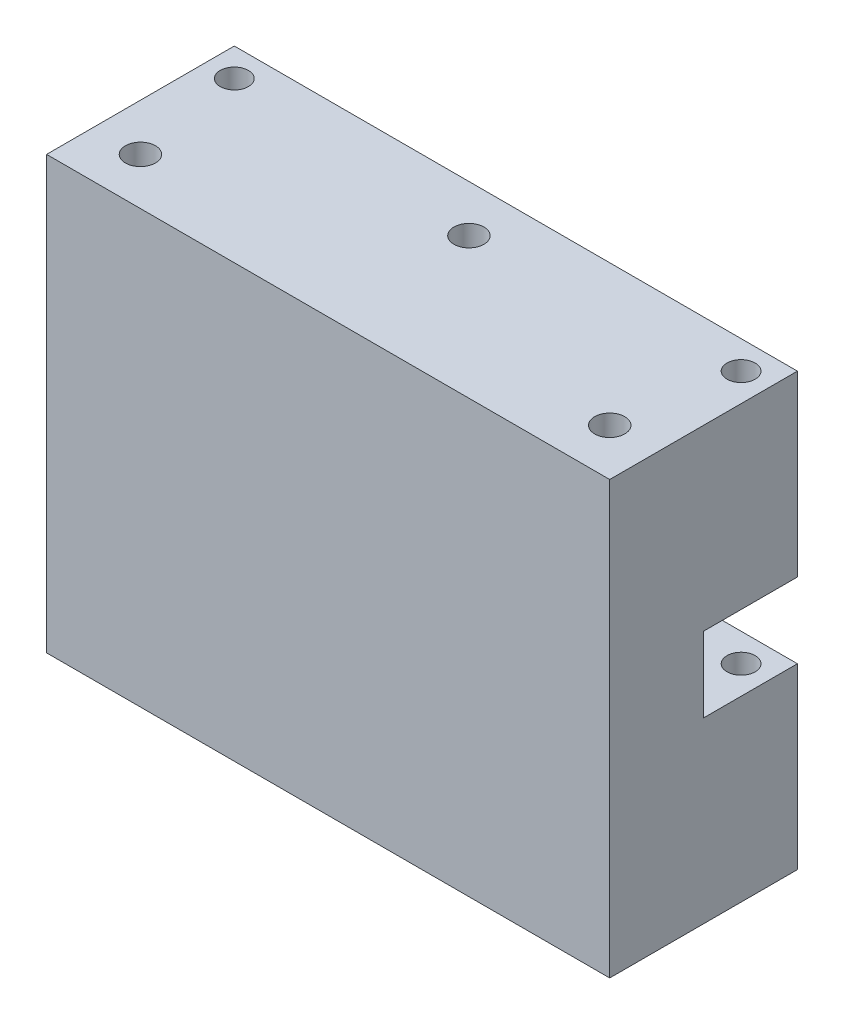
from build123d import *

# Parameters (mm, degrees)
SKETCH1_W             = 60
SKETCH1_H             = 20
BOSS_EXTRUDE1_DEPTH   = 46
SKETCH2_W             = 10
SKETCH2_H             = 8
CUT_EXTRUDE1_DEPTH    = 10
F_3_0MM_DOWEL_HOLE1_D = 3
SKETCH5_W             = 10
SKETCH5_H             = 10
CUT_EXTRUDE2_DEPTH    = 10
M3_CLEARANCE_HOLE1_D  = 3.2


with BuildPart() as part:
    # Sketch1 → Boss-Extrude1 (new body)
    with BuildSketch(Plane(origin=(0, 0, 0), x_dir=(1, 0, 0), z_dir=(0, 1, 0))):
        Rectangle(SKETCH1_W, SKETCH1_H)
    extrude(amount=BOSS_EXTRUDE1_DEPTH)

    # Sketch2 → Cut-Extrude1 (cut)
    with BuildSketch(Plane(origin=(30, 0, 0), x_dir=(0, 0, -1), z_dir=(1, 0, 0))):
        with Locations((5, 23)):
            Rectangle(SKETCH2_W, SKETCH2_H)
    extrude(amount=-CUT_EXTRUDE1_DEPTH, mode=Mode.SUBTRACT)

    # Ø3.0mm Dowel Hole1 (through all)
    with Locations(Plane(origin=(0, 46, 0), x_dir=(1, 0, 0), z_dir=(0, 1, 0))):
        with Locations((-27, 7), (27, 7)):
            Hole(F_3_0MM_DOWEL_HOLE1_D / 2)

    # Sketch5 → Cut-Extrude2 (cut)
    with BuildSketch(Plane.ZY.offset(30)):
        with Locations((-5, 23)):
            Rectangle(SKETCH5_W, SKETCH5_H)
    extrude(amount=-CUT_EXTRUDE2_DEPTH, mode=Mode.SUBTRACT)

    # M3 Clearance Hole1 (through all)
    with Locations(Plane(origin=(0, 46, 0), x_dir=(1, 0, 0), z_dir=(0, 1, 0))):
        with Locations((-25, -5), (0, 5), (25, -5)):
            Hole(M3_CLEARANCE_HOLE1_D / 2)


solid = part.part
